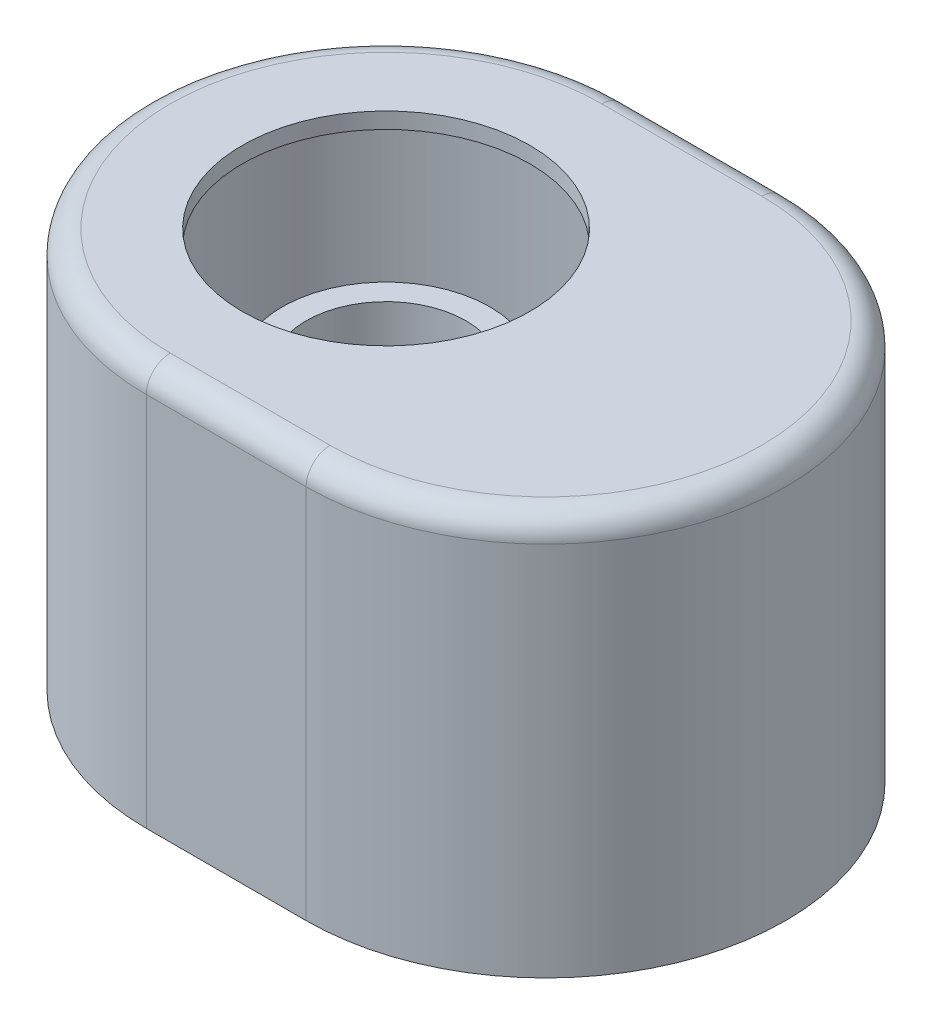
from build123d import *

# Parameters (mm, degrees)
EXTRUDE_1_DEPTH     = 50
FILLET_1_R          = 3
SHELL_1_T           = -2
CUT_EXTRUDE_1_REACH = 78.811
SKETCH_2_R          = 18


with BuildPart() as part:
    # 草图1 → 凸台-拉伸1 (new body)
    with BuildSketch(Plane(origin=(0, 0, 0), x_dir=(1, 0, 0), z_dir=(0, 1, 0))):
        with BuildLine():
            Line((0, 30), (20, 30))
            ThreePointArc((20, 30), (50, 0), (20, -30))
            Line((20, -30), (0, -30))
            ThreePointArc((0, -30), (-30, 0), (0, 30))
        make_face()
    extrude(amount=EXTRUDE_1_DEPTH)

    # 圆角1
    fillet_1_edges = [part.edges().sort_by_distance(p)[0] for p in [
        (50, 50, 0),
        (10, 50, -30),
        (-30, 50, 0),
        (10, 50, 30),
    ]]
    fillet(fillet_1_edges, radius=FILLET_1_R)

    # 抽壳1
    shell_1_openings = [part.faces().sort_by_distance(p)[0] for p in [
        (10, 0, 0),
    ]]
    offset(amount=SHELL_1_T, openings=shell_1_openings, kind=Kind.INTERSECTION)

    # 草图2 → 切除-拉伸1 (cut, up to next)
    with BuildSketch(Plane(origin=(0, 50, 0), x_dir=(1, 0, 0), z_dir=(0, 1, 0)), mode=Mode.PRIVATE) as cut_extrude_1_sk1:
        with Locations(Location((0, 0, 0), (0, 0, 270))):
            Circle(SKETCH_2_R)
    cut_extrude_1_tool1 = extrude(cut_extrude_1_sk1.sketch, amount=-CUT_EXTRUDE_1_REACH, mode=Mode.PRIVATE) & part.part
    add(cut_extrude_1_tool1.solids().sort_by_distance((0, 50, 0))[0], mode=Mode.SUBTRACT)


with BuildPart() as body_2:
    # 草图3 → 旋转1 (revolve)
    with BuildSketch(Plane.XY, mode=Mode.PRIVATE) as revolve_1_sk:
        Polygon((-10, 35), (-13, 35), (-13, 27.632889149), (-9.5, 21.632889149), (-9.5, 15), (-6.5, 15), (-6.5, 19), (-4.5, 19), (-4.5, 21), (-8, 27), (-8, 29), (-10, 29), align=None)
    revolve(revolve_1_sk.sketch.rotate(Axis((0, 0, 0), (0, 1, 0)), 270), axis=Axis((0, 0, 0), (0, 1, 0)))


solid = Compound([part.part, body_2.part])
